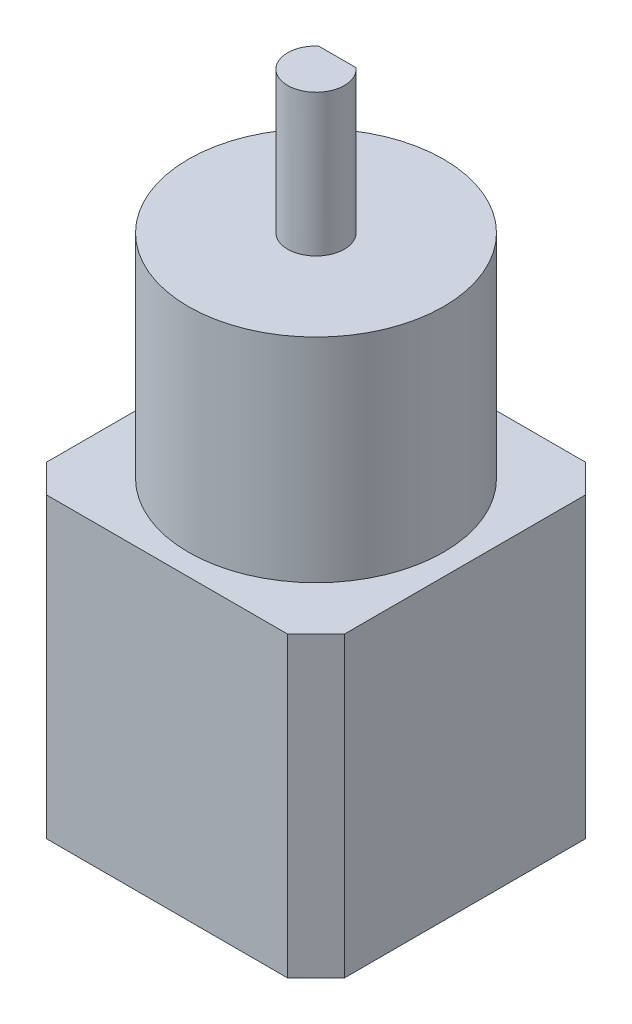
from build123d import *

# Parameters (mm, degrees)
SKETCH_1_W          = 42
SKETCH_1_H          = 42
EXTRUDE_1_DEPTH     = 21
CHAMFER_1_SIZE      = 4
SKETCH_2_R          = 18
EXTRUDE_2_DEPTH     = 30
SKETCH_3_R          = 4
EXTRUDE_3_DEPTH     = 20
CUT_EXTRUDE_START   = -15
CUT_EXTRUDE_1_DEPTH = 15


with BuildPart() as part:
    # 스케치1 → 보스-돌출1 (new, symmetric)
    with BuildSketch(Plane(origin=(0, 0, 0), x_dir=(1, 0, 0), z_dir=(0, 1, 0))):
        Rectangle(SKETCH_1_W, SKETCH_1_H)
    extrude(amount=EXTRUDE_1_DEPTH, both=True)

    # 모따기1
    chamfer_1_edges = [part.edges().sort_by_distance(p)[0] for p in [
        (21, 0, 21),
        (-21, 0, 21),
        (-21, 0, -21),
        (21, 0, -21),
    ]]
    chamfer(chamfer_1_edges, length=CHAMFER_1_SIZE)

    # 스케치2 → 보스-돌출2 (add)
    with BuildSketch(Plane(origin=(0, 21, 0), x_dir=(1, 0, 0), z_dir=(0, 1, 0))):
        with Locations(Location((0, 0, 0), (0, 0, 270))):
            Circle(SKETCH_2_R)
    extrude(amount=EXTRUDE_2_DEPTH)

    # 스케치3 → 보스-돌출3 (add)
    with BuildSketch(Plane(origin=(0, 51, 0), x_dir=(1, 0, 0), z_dir=(0, 1, 0))):
        with Locations(Location((0, 0, 0), (0, 0, 270))):
            Circle(SKETCH_3_R)
    extrude(amount=EXTRUDE_3_DEPTH)

    # 스케치4 → 컷-돌출1 (cut)
    with BuildSketch(Plane(origin=(0, 71, 0), x_dir=(1, 0, 0), z_dir=(0, 1, 0)).offset(CUT_EXTRUDE_START)):
        with BuildLine():
            Line((-2.645751311, 3), (2.645751311, 3))
            ThreePointArc((2.645751311, 3), (0, 4), (-2.645751311, 3))
        make_face()
    extrude(amount=CUT_EXTRUDE_1_DEPTH, mode=Mode.SUBTRACT)


solid = part.part
